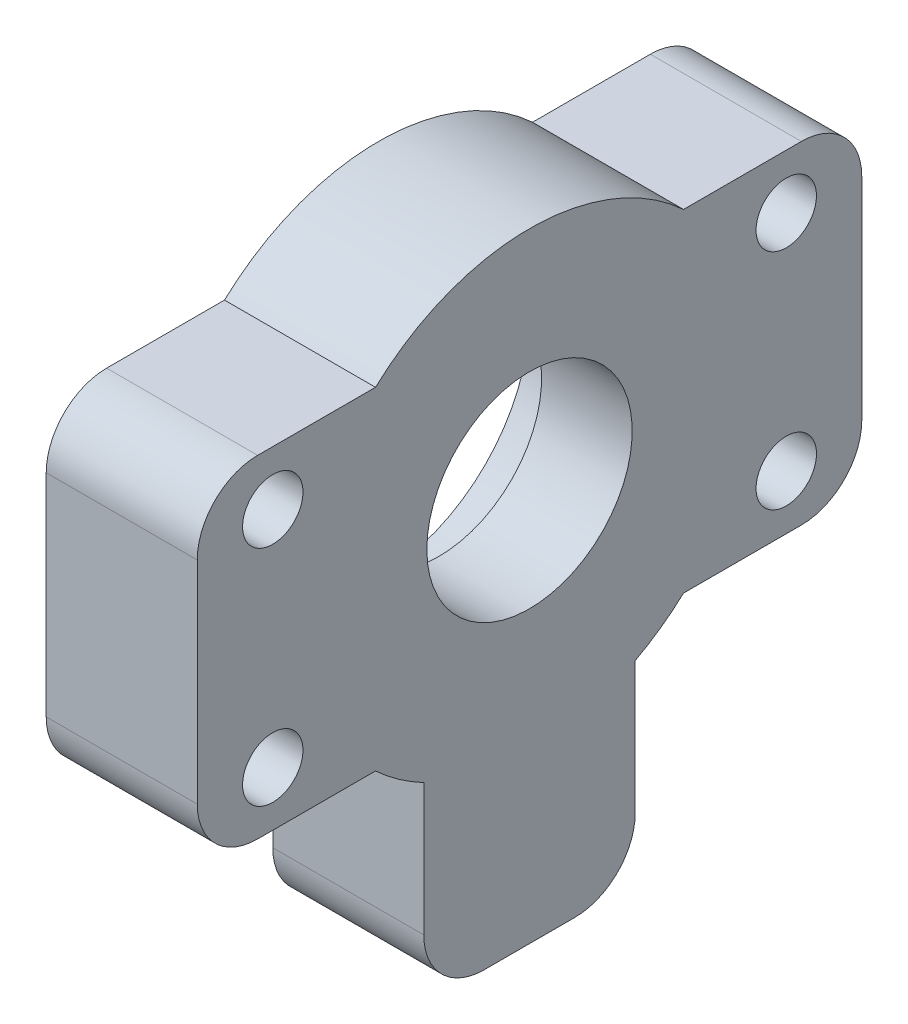
from build123d import *

# Parameters (mm, degrees)
SKETCH_1_R          = 7.5
EXTRUDE_1_DEPTH     = 5
SKETCH_2_R          = 5
CUT_EXTRUDE_1_DEPTH = 2
SKETCH_3_R          = 3.4
CUT_EXTRUDE_2_DEPTH = 12.022703843
SKETCH_4_W          = 6
SKETCH_4_H          = 11
EXTRUDE_2_DEPTH     = 5
FILLET_1_R          = 2
SKETCH_8_R          = 1
CUT_EXTRUDE_4_DEPTH = 15.221462653
SKETCH_9_W          = 7
SKETCH_9_H          = 7.5
EXTRUDE_3_DEPTH     = 5
FILLET_2_R          = 2


with BuildPart() as part:
    # 草图1 → 凸台-拉伸1 (new body)
    with BuildSketch(Plane(origin=(0, 0, 0), x_dir=(0, 0, -1), z_dir=(1, 0, 0))):
        Circle(SKETCH_1_R)
    extrude(amount=EXTRUDE_1_DEPTH)

    # 草图2 → 切除-拉伸1 (cut)
    with BuildSketch(Plane.ZY):
        Circle(SKETCH_2_R)
    extrude(amount=-CUT_EXTRUDE_1_DEPTH, mode=Mode.SUBTRACT)

    # 草图3 → 切除-拉伸2 (cut, through all)
    with BuildSketch(Plane.ZY.offset(-2)):
        Circle(SKETCH_3_R)
    extrude(amount=-CUT_EXTRUDE_2_DEPTH, mode=Mode.SUBTRACT)

    # 草图4 → 凸台-拉伸2 (add)
    with BuildSketch(Plane.ZY):
        with Locations((8, 0)):
            Rectangle(SKETCH_4_W, SKETCH_4_H)
        with Locations((-8, 0)):
            Rectangle(SKETCH_4_W, SKETCH_4_H)
    extrude(amount=-EXTRUDE_2_DEPTH)

    # 草图6 → 切除-旋转1 (revolve, cut)
    with BuildSketch(Plane.ZY):
        with BuildLine():
            Line((8, 2.65), (8, -2.65))
            ThreePointArc((8, -2.65), (10.65, 0), (8, 2.65))
        make_face()
    revolve(axis=Axis((0, 2.65, 8), (0, -1, 0)), mode=Mode.SUBTRACT)

    # 草图7 → 切除-旋转2 (revolve, cut)
    with BuildSketch(Plane.ZY):
        with BuildLine():
            Line((-8, 2.65), (-8, -2.65))
            ThreePointArc((-8, -2.65), (-5.35, 0), (-8, 2.65))
        make_face()
    revolve(axis=Axis((0, 2.65, -8), (0, -1, 0)), mode=Mode.SUBTRACT)

    # 圆角1
    fillet_1_edges = [part.edges().sort_by_distance(p)[0] for p in [
        (2.5, -5.5, 11),
        (2.5, 5.5, 11),
        (2.5, 5.5, -11),
        (2.5, -5.5, -11),
    ]]
    fillet(fillet_1_edges, radius=FILLET_1_R)

    # 草图8 → 切除-拉伸4 (cut, through all)
    with BuildSketch(Plane.ZY):
        with Locations((8.5, -3.7)):
            Circle(SKETCH_8_R)
        with Locations(Location((8.5, 3.7, 0), (0, 0, 180))):
            Circle(SKETCH_8_R)
        with Locations(Location((-8.5, -3.7, 0), (0, 0, 180))):
            Circle(SKETCH_8_R)
        with Locations((-8.5, 3.7)):
            Circle(SKETCH_8_R)
    extrude(amount=-CUT_EXTRUDE_4_DEPTH, mode=Mode.SUBTRACT)

    # 草图9 → 凸台-拉伸3 (add)
    with BuildSketch(Plane(origin=(5, 0, 0), x_dir=(0, 0, -1), z_dir=(1, 0, 0))):
        with Locations((0, -9.25)):
            Rectangle(SKETCH_9_W, SKETCH_9_H)
    extrude(amount=-EXTRUDE_3_DEPTH)

    # 草图10 → 切除-旋转3 (revolve, cut)
    with BuildSketch(Plane.ZY):
        with BuildLine():
            Line((0, -7.35), (0, -12.65))
            ThreePointArc((0, -12.65), (-2.65, -10), (0, -7.35))
        make_face()
    revolve(axis=Axis((0, -7.35, 0), (0, -1, 0)), mode=Mode.SUBTRACT)

    # 圆角2
    fillet_2_edges = [part.edges().sort_by_distance(p)[0] for p in [
        (2.5, -13, 3.5),
        (2.5, -13, -3.5),
    ]]
    fillet(fillet_2_edges, radius=FILLET_2_R)


solid = part.part
